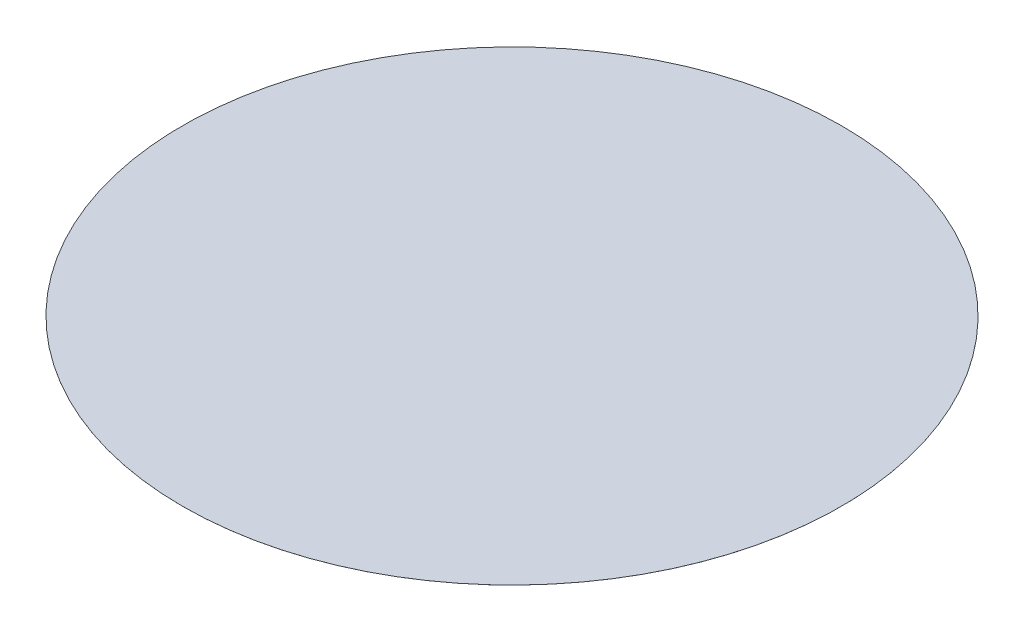
from build123d import *

# Parameters (mm, degrees)
SKETCH1_R                         = 1418
CRX_10IAL_MAXREACHREFERENCE_DEPTH = 0.1


with BuildPart() as part:
    # Sketch1 → CRX-10iAL_MaxReachReference (new body)
    with BuildSketch(Plane(origin=(0, 0, 0), x_dir=(1, 0, 0), z_dir=(0, 1, 0))):
        Circle(SKETCH1_R)
    extrude(amount=CRX_10IAL_MAXREACHREFERENCE_DEPTH)


solid = part.part
